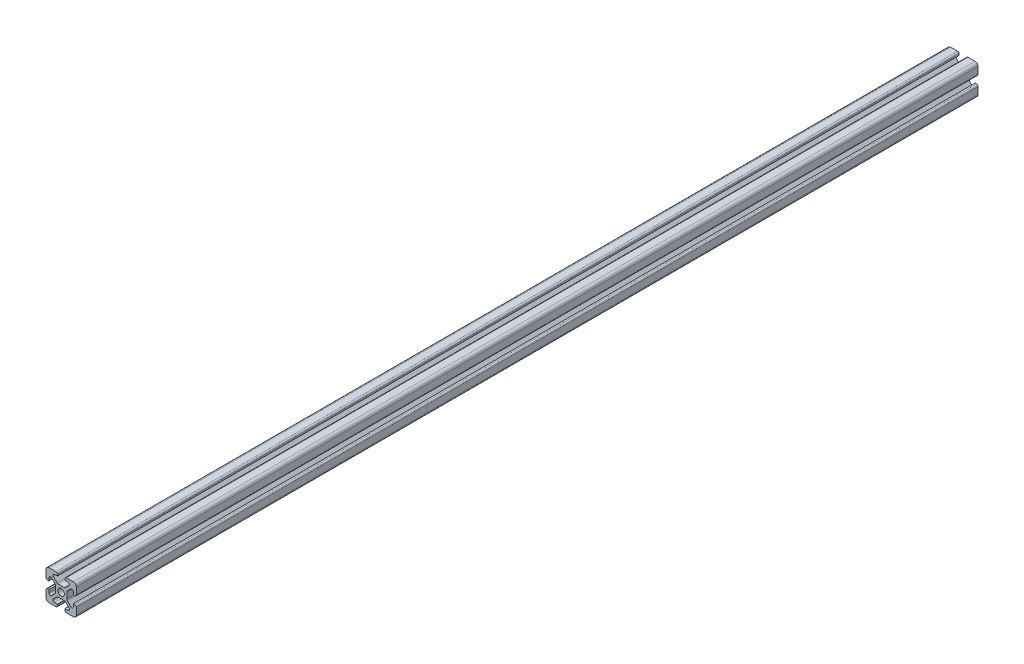
from build123d import *

# Parameters (mm, degrees)
SKETCH1_R           = 2.15
BOSS_EXTRUDE1_DEPTH = 600


with BuildPart() as part:
    # Sketch1 → Boss-Extrude1 (new body)
    with BuildSketch(Plane.XY):
        with BuildLine():
            Line((2, 0), (6.6, 0))
            ThreePointArc((6.6, 0), (7.307106781, 0.292893219), (7.6, 1))
            Line((7.6, 1), (7.6, 2))
            Line((7.6, 2), (5.664213562, 2))
            ThreePointArc((5.664213562, 2), (4.74033403, 2.617316568), (4.957106781, 3.707106781))
            Line((4.957106781, 3.707106781), (7.307106781, 6.057106781))
            ThreePointArc((7.307106781, 6.057106781), (7.63153013, 6.273879533), (8.014213562, 6.35))
            Line((8.014213562, 6.35), (12.185786438, 6.35))
            ThreePointArc((12.185786438, 6.35), (12.56846987, 6.273879533), (12.892893219, 6.057106781))
            Line((12.892893219, 6.057106781), (15.242893219, 3.707106781))
            ThreePointArc((15.242893219, 3.707106781), (15.45966597, 2.617316568), (14.535786438, 2))
            Line((14.535786438, 2), (12.6, 2))
            Line((12.6, 2), (12.6, 1))
            ThreePointArc((12.6, 1), (12.892893219, 0.292893219), (13.6, 0))
            Line((13.6, 0), (18.2, 0))
            ThreePointArc((18.2, 0), (19.614213562, 0.585786438), (20.2, 2))
            Line((20.2, 2), (20.2, 6.6))
            ThreePointArc((20.2, 6.6), (19.907106781, 7.307106781), (19.2, 7.6))
            Line((19.2, 7.6), (18.2, 7.6))
            Line((18.2, 7.6), (18.2, 5.664213562))
            ThreePointArc((18.2, 5.664213562), (17.582683432, 4.74033403), (16.492893219, 4.957106781))
            Line((16.492893219, 4.957106781), (14.142893219, 7.307106781))
            ThreePointArc((14.142893219, 7.307106781), (13.926120467, 7.63153013), (13.85, 8.014213562))
            Line((13.85, 8.014213562), (13.85, 12.185786438))
            ThreePointArc((13.85, 12.185786438), (13.926120467, 12.56846987), (14.142893219, 12.892893219))
            Line((14.142893219, 12.892893219), (16.492893219, 15.242893219))
            ThreePointArc((16.492893219, 15.242893219), (17.582683432, 15.45966597), (18.2, 14.535786438))
            Line((18.2, 14.535786438), (18.2, 12.6))
            Line((18.2, 12.6), (19.2, 12.6))
            ThreePointArc((19.2, 12.6), (19.907106781, 12.892893219), (20.2, 13.6))
            Line((20.2, 13.6), (20.2, 18.2))
            ThreePointArc((20.2, 18.2), (19.614213562, 19.614213562), (18.2, 20.2))
            Line((18.2, 20.2), (13.6, 20.2))
            ThreePointArc((13.6, 20.2), (12.892893219, 19.907106781), (12.6, 19.2))
            Line((12.6, 19.2), (12.6, 18.2))
            Line((12.6, 18.2), (14.535786438, 18.2))
            ThreePointArc((14.535786438, 18.2), (15.45966597, 17.582683432), (15.242893219, 16.492893219))
            Line((15.242893219, 16.492893219), (12.892893219, 14.142893219))
            ThreePointArc((12.892893219, 14.142893219), (12.56846987, 13.926120467), (12.185786438, 13.85))
            Line((12.185786438, 13.85), (8.014213562, 13.85))
            ThreePointArc((8.014213562, 13.85), (7.63153013, 13.926120467), (7.307106781, 14.142893219))
            Line((7.307106781, 14.142893219), (4.957106781, 16.492893219))
            ThreePointArc((4.957106781, 16.492893219), (4.74033403, 17.582683432), (5.664213562, 18.2))
            Line((5.664213562, 18.2), (7.6, 18.2))
            Line((7.6, 18.2), (7.6, 19.2))
            ThreePointArc((7.6, 19.2), (7.307106781, 19.907106781), (6.6, 20.2))
            Line((6.6, 20.2), (2, 20.2))
            ThreePointArc((2, 20.2), (0.585786438, 19.614213562), (0, 18.2))
            Line((0, 18.2), (0, 13.6))
            ThreePointArc((0, 13.6), (0.292893219, 12.892893219), (1, 12.6))
            Line((1, 12.6), (2, 12.6))
            Line((2, 12.6), (2, 14.535786438))
            ThreePointArc((2, 14.535786438), (2.617316568, 15.45966597), (3.707106781, 15.242893219))
            Line((3.707106781, 15.242893219), (6.057106781, 12.892893219))
            ThreePointArc((6.057106781, 12.892893219), (6.273879533, 12.56846987), (6.35, 12.185786438))
            Line((6.35, 12.185786438), (6.35, 8.014213562))
            ThreePointArc((6.35, 8.014213562), (6.273879533, 7.63153013), (6.057106781, 7.307106781))
            Line((6.057106781, 7.307106781), (3.707106781, 4.957106781))
            ThreePointArc((3.707106781, 4.957106781), (2.617316568, 4.74033403), (2, 5.664213562))
            Line((2, 5.664213562), (2, 7.6))
            Line((2, 7.6), (1, 7.6))
            ThreePointArc((1, 7.6), (0.292893219, 7.307106781), (0, 6.6))
            Line((0, 6.6), (0, 2))
            ThreePointArc((0, 2), (0.585786438, 0.585786438), (2, 0))
        make_face()
        with Locations((10.1, 10.1)):
            Circle(SKETCH1_R, mode=Mode.SUBTRACT)
    extrude(amount=BOSS_EXTRUDE1_DEPTH)


solid = part.part
